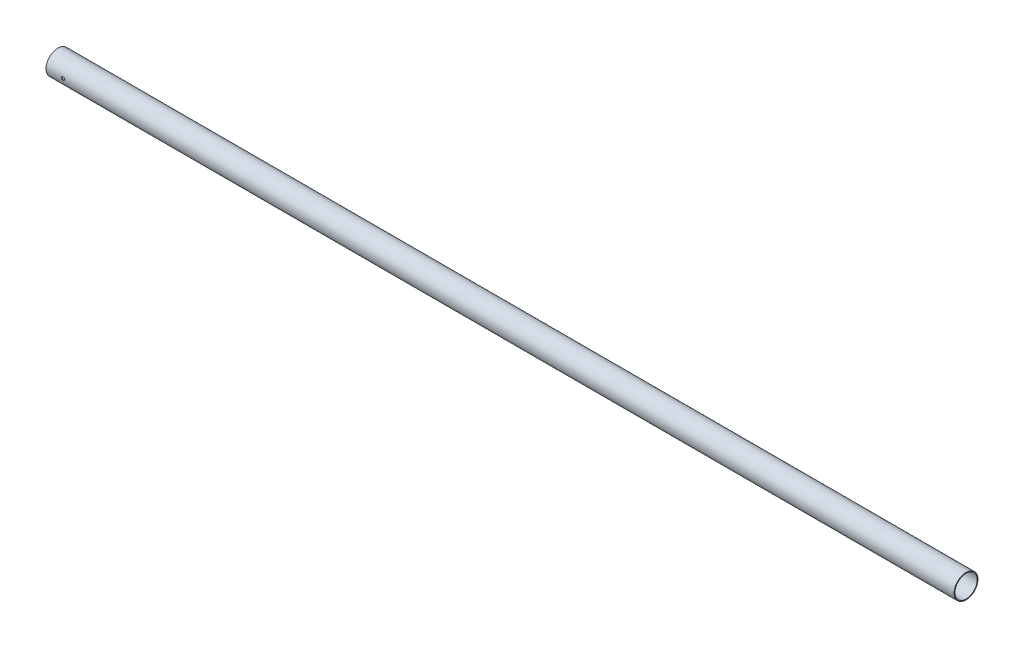
from build123d import *

# Parameters (mm, degrees)
SKETCH1_R               = 12.7
SKETCH1_R_2             = 11.811
BOSS_EXTRUDE1_DEPTH     = 965.67
CUT_EXTRUDE1_DEPTH      = 966.83700949
CUT_EXTRUDE1_DEPTH_BACK = 966.83700949
SKETCH2_R               = 1.7


with BuildPart() as part:
    # Sketch1 → Boss-Extrude1 (new body)
    with BuildSketch(Plane(origin=(0, 0, 0), x_dir=(0, 0, -1), z_dir=(1, 0, 0))):
        Circle(SKETCH1_R)
        Circle(SKETCH1_R_2, mode=Mode.SUBTRACT)
    extrude(amount=BOSS_EXTRUDE1_DEPTH)

    # Sketch2 → Cut-Extrude1 (cut, two sides: drawn at the far end of the back side and taken through both)
    with BuildSketch(Plane.XY.offset(-CUT_EXTRUDE1_DEPTH_BACK)):
        with Locations((18, 0)):
            Circle(SKETCH2_R)
    extrude(amount=CUT_EXTRUDE1_DEPTH + CUT_EXTRUDE1_DEPTH_BACK, mode=Mode.SUBTRACT)


solid = part.part
